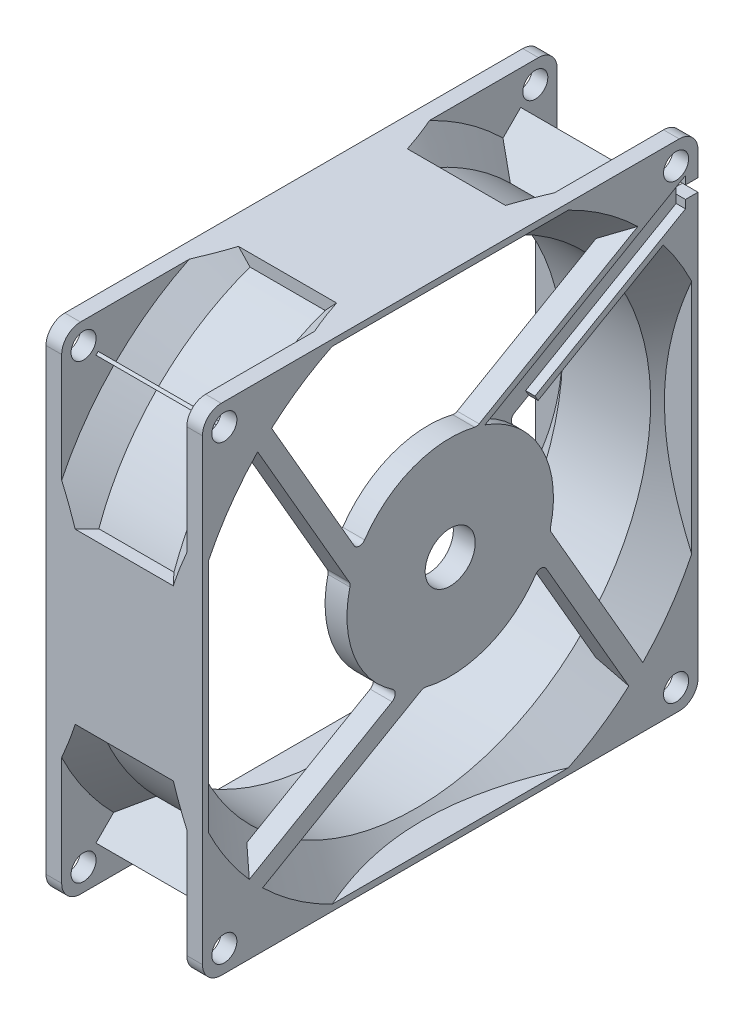
from build123d import *

# Parameters (mm, degrees)
SKETCH2_OUTSIDE_W               = 146.07
SKETCH2_OUTSIDE_H               = 146.07
CUT_EXTRUDE1_DEPTH              = 84.04817878797823
BOSS_EXTRUDE1_REACH             = 63.327
SKETCH3_W                       = 37.74341300100707
SKETCH3_H                       = 1
CIRPATTERN1_COUNT               = 4
MIRROR1_COPY_1_REACH            = 63.327
MIRROR1_COPY_1_SKETCH_W         = 37.74341300100707
MIRROR1_COPY_1_SKETCH_H         = 1
MIRROR1_COPY_2_REACH            = 63.327
MIRROR1_COPY_2_SKETCH_W         = 37.74341300100707
MIRROR1_COPY_2_SKETCH_H         = 1
MIRROR1_COPY_3_REACH            = 63.327
MIRROR1_COPY_3_SKETCH_W         = 37.74341300100707
MIRROR1_COPY_3_SKETCH_H         = 1
BOSS_EXTRUDE2_REACH             = 59.378
BOSS_EXTRUDE2_DIRECTION_2_REACH = 59.378
CIRPATTERN2_COUNT               = 4
SKETCH5_R                       = 2.0000000000000036
CUT_EXTRUDE2_DEPTH              = 62.32699242584839
CIRPATTERN3_COUNT               = 4
FILLET1_R                       = 3
SKETCH6_R                       = 4
BOSS_EXTRUDE3_DEPTH             = 3.5
CUT_EXTRUDE3_DEPTH              = 1.5
CUT_EXTRUDE4_REACH              = 62.731
SKETCH8_W                       = 2
SKETCH8_H                       = 2.0000000000000036
FILLET2_R                       = 1
BOSS_EXTRUDE4_REACH             = 91.422
BOSS_EXTRUDE4_END_RADIUS        = 40
CIRPATTERN4_COUNT               = 4


with BuildPart() as part:
    # Sketch1 → Revolve1 (revolve)
    with BuildSketch(Plane.XY, mode=Mode.PRIVATE) as revolve1_sk:
        Polygon((-9.999999999999982, 55.99999999999999), (-9.999999999999979, 44), (-6, 40), (6, 40), (9.99999999999998, 44), (9.999999999999979, 55.99999999999999), (12.499999999999982, 55.99999999999999), (12.499999999999984, 42.96446609406725), (7.035533905932737, 37.5), (-7.035533905932737, 37.5), (-12.499999999999979, 42.96446609406726), (-12.499999999999982, 55.99999999999999), align=None)
    revolve(revolve1_sk.sketch.rotate(Axis((-12.499999999999979, 0, 0), (1, 0, 0)), 90), axis=Axis((-12.499999999999979, 0, 0), (1, 0, 0)))

    # Sketch2 outside → Cut-Extrude1 (cut, through all)
    with BuildSketch(Plane(origin=(12.499999999999984, 0, 0), x_dir=(0, 0, -1), z_dir=(1, 0, 0))):
        Rectangle(SKETCH2_OUTSIDE_W, SKETCH2_OUTSIDE_H)
        Polygon((-39.59797974644666, 39.59797974644666), (39.59797974644666, 39.59797974644666), (39.59797974644667, -39.59797974644666), (-39.597979746446654, -39.59797974644666), align=None, mode=Mode.SUBTRACT)
    extrude(amount=-CUT_EXTRUDE1_DEPTH, mode=Mode.SUBTRACT)

    # Sketch3 → Boss-Extrude1 (add, up to next)
    with BuildSketch(Plane(origin=(12.499999999999984, 0, 0), x_dir=(0, 0, -1), z_dir=(1, 0, 0)), mode=Mode.PRIVATE) as boss_extrude1_sk1:
        with Locations((0, 39.09797974644666)):
            Rectangle(SKETCH3_W, SKETCH3_H)
    boss_extrude1_tool1 = extrude(boss_extrude1_sk1.sketch, amount=-BOSS_EXTRUDE1_REACH, mode=Mode.PRIVATE) - part.part
    boss_extrude1 = boss_extrude1_tool1.solids().sort_by_distance((12.5, 39.09798, 0))[0]
    add(boss_extrude1)

    # CirPattern1: Boss-Extrude1 ×4 about axis
    cirpattern1_axis = Axis((0, 0, 0), (1, 0, 0))
    for i in range(1, CIRPATTERN1_COUNT):
        add(boss_extrude1.rotate(cirpattern1_axis, i * 360 / CIRPATTERN1_COUNT))

    # Mirror1: Boss-Extrude1 across plane
    add(boss_extrude1.mirror(Plane(origin=(0, 0, 0), x_dir=(0, 0, 1), z_dir=(1, 0, 0))))

    # Mirror1 copy 1 sketch → Mirror1 copy 1 (add, up to next)
    with BuildSketch(Plane(origin=(-12.499999999999984, 0, 0), x_dir=(0, 1, -6e-17), z_dir=(-1, 0, 0)), mode=Mode.PRIVATE) as mirror1_copy_1_sk1:
        with Locations((0, -39.09797974644666)):
            Rectangle(MIRROR1_COPY_1_SKETCH_W, MIRROR1_COPY_1_SKETCH_H)
    mirror1_copy_1_tool1 = extrude(mirror1_copy_1_sk1.sketch, amount=-MIRROR1_COPY_1_REACH, mode=Mode.PRIVATE) - part.part
    add(mirror1_copy_1_tool1.solids().sort_by_distance((-12.5, 0, 39.09798))[0])

    # Mirror1 copy 2 sketch → Mirror1 copy 2 (add, up to next)
    with BuildSketch(Plane.ZY.offset(12.499999999999984), mode=Mode.PRIVATE) as mirror1_copy_2_sk1:
        with Locations((0, -39.09797974644666)):
            Rectangle(MIRROR1_COPY_2_SKETCH_W, MIRROR1_COPY_2_SKETCH_H)
    mirror1_copy_2_tool1 = extrude(mirror1_copy_2_sk1.sketch, amount=-MIRROR1_COPY_2_REACH, mode=Mode.PRIVATE) - part.part
    add(mirror1_copy_2_tool1.solids().sort_by_distance((-12.5, -39.09798, 0))[0])

    # Mirror1 copy 3 sketch → Mirror1 copy 3 (add, up to next)
    with BuildSketch(Plane(origin=(-12.499999999999984, 0, 0), x_dir=(0, -1, 1.8e-16), z_dir=(-1, 0, 0)), mode=Mode.PRIVATE) as mirror1_copy_3_sk1:
        with Locations((0, -39.09797974644666)):
            Rectangle(MIRROR1_COPY_3_SKETCH_W, MIRROR1_COPY_3_SKETCH_H)
    mirror1_copy_3_tool1 = extrude(mirror1_copy_3_sk1.sketch, amount=-MIRROR1_COPY_3_REACH, mode=Mode.PRIVATE) - part.part
    add(mirror1_copy_3_tool1.solids().sort_by_distance((-12.5, 0, -39.09798))[0])

    # Sketch4 → Boss-Extrude2 (add, up to next)
    with BuildSketch(Plane(origin=(0, 0, 0), x_dir=(0, 0, -1), z_dir=(1, 0, 0)), mode=Mode.PRIVATE) as boss_extrude2_sk1:
        Polygon((33.76434880165763, 34.117902192250924), (26.33913833700047, 26.69269172759376), (26.69269172759376, 26.33913833700047), (34.11790219225093, 33.764348801657626), align=None)
    boss_extrude2_tool1 = extrude(boss_extrude2_sk1.sketch, amount=BOSS_EXTRUDE2_REACH, mode=Mode.PRIVATE) - part.part
    boss_extrude2 = boss_extrude2_tool1.solids().sort_by_distance((0, 30.22852, -30.22852))[0]
    add(boss_extrude2)

    # Sketch4 → Boss-Extrude2 direction 2 (add, up to next)
    with BuildSketch(Plane(origin=(0, 0, 0), x_dir=(0, 0, -1), z_dir=(1, 0, 0)), mode=Mode.PRIVATE) as boss_extrude2_direction_2_sk1:
        Polygon((33.76434880165763, 34.117902192250924), (26.33913833700047, 26.69269172759376), (26.69269172759376, 26.33913833700047), (34.11790219225093, 33.764348801657626), align=None)
    boss_extrude2_direction_2_tool1 = extrude(boss_extrude2_direction_2_sk1.sketch, amount=-BOSS_EXTRUDE2_DIRECTION_2_REACH, mode=Mode.PRIVATE) - part.part
    boss_extrude2_direction_2 = boss_extrude2_direction_2_tool1.solids().sort_by_distance((0, 30.22852, -30.22852))[0]
    add(boss_extrude2_direction_2)

    # CirPattern2: Boss-Extrude2, Boss-Extrude2 direction 2 ×4 about axis
    cirpattern2_axis = Axis((0, 7e-17, 2.03e-15), (1, 0, 0))
    add([boss_extrude2.rotate(cirpattern2_axis, i * 360 / CIRPATTERN2_COUNT) for i in range(1, CIRPATTERN2_COUNT)])
    add([boss_extrude2_direction_2.rotate(cirpattern2_axis, i * 360 / CIRPATTERN2_COUNT) for i in range(1, CIRPATTERN2_COUNT)])

    # Sketch5 → Cut-Extrude2 (cut, through all)
    with BuildSketch(Plane(origin=(12.499999999999984, 0, 0), x_dir=(0, 0, -1), z_dir=(1, 0, 0))):
        with Locations((36.09797974644666, -36.097979746446654)):
            Circle(SKETCH5_R)
    cut_extrude2 = extrude(amount=-CUT_EXTRUDE2_DEPTH, mode=Mode.SUBTRACT)

    # CirPattern3: Cut-Extrude2 ×4 about axis
    cirpattern3_axis = Axis((0, -6.245e-14, 6.245e-14), (1, 0, 0))
    for i in range(1, CIRPATTERN3_COUNT):
        add(cut_extrude2.rotate(cirpattern3_axis, i * 360 / CIRPATTERN3_COUNT), mode=Mode.SUBTRACT)

    # Fillet1
    fillet1_edges = [part.edges().sort_by_distance(p)[0] for p in [
        (11.249999999999982, -39.59797974644666, -39.59797974644667),
        (-11.24999999999998, -39.59797974644666, -39.59797974644667),
        (11.249999999999982, -39.59797974644666, 39.597979746446654),
        (-11.24999999999998, -39.59797974644666, 39.597979746446654),
        (11.249999999999982, 39.59797974644666, 39.59797974644666),
        (-11.24999999999998, 39.59797974644666, 39.59797974644666),
        (11.249999999999982, 39.59797974644666, -39.59797974644666),
        (-11.24999999999998, 39.59797974644666, -39.59797974644666),
    ]]
    fillet(fillet1_edges, radius=FILLET1_R)

    # Sketch6 → Boss-Extrude3 (add)
    with BuildSketch(Plane(origin=(12.499999999999984, 0, 0), x_dir=(0, 0, -1), z_dir=(1, 0, 0))):
        with BuildLine():
            Line((29.976496953072278, 30.779132170525894), (4.270514244191484, 15.937776133769656))
            ThreePointArc((4.270514244191484, 15.937776133769656), (-6.5380934396241654, 15.149367451307777), (-14.526193110031757, 7.825580727975779))
            Line((-14.526193110031757, 7.825580727975779), (-28.54664833090146, 32.10972151576676))
            ThreePointArc((-28.54664833090146, 32.10972151576676), (-29.68206057174266, 31.063171553523844), (-30.779132170525745, 29.976496953072438))
            Line((-30.779132170525745, 29.976496953072438), (-15.937776133769656, 4.270514244191488))
            ThreePointArc((-15.937776133769656, 4.270514244191488), (-15.149367451307702, -6.5380934396243395), (-7.825580727975507, -14.526193110032072))
            Line((-7.825580727975507, -14.526193110032072), (-32.10972151576648, -28.546648330901775))
            ThreePointArc((-32.10972151576648, -28.546648330901775), (-31.06317155352356, -29.682060571742976), (-29.97649695307216, -30.779132170526058))
            Line((-29.97649695307216, -30.779132170526058), (-4.270514244191213, -15.937776133769969))
            ThreePointArc((-4.270514244191213, -15.937776133769969), (6.538093439624522, -15.149367451307873), (14.526193110032342, -7.825580727975819))
            Line((14.526193110032342, -7.825580727975819), (28.54664833090205, -32.10972151576679))
            ThreePointArc((28.54664833090205, -32.10972151576679), (29.682060571743243, -31.063171553523873), (30.77913217052633, -29.976496953072477))
            Line((30.77913217052633, -29.976496953072477), (15.937776133770239, -4.270514244191527))
            ThreePointArc((15.937776133770239, -4.270514244191527), (15.732495145305311, 4.9737909589129075), (10.586469911992962, 12.65609160848908))
            Line((10.586469911992962, 12.65609160848908), (34.04957142522472, 26.202519583176993))
            ThreePointArc((34.04957142522472, 26.202519583176993), (32.09471457560046, 28.56351944454662), (29.976496953072278, 30.779132170525894))
        make_face()
        Circle(SKETCH6_R, mode=Mode.SUBTRACT)
    extrude(amount=-BOSS_EXTRUDE3_DEPTH)

    # Sketch7 → Cut-Extrude3 (cut)
    with BuildSketch(Plane(origin=(12.499999999999984, 0, 0), x_dir=(0, 0, -1), z_dir=(1, 0, 0))):
        with BuildLine():
            Line((5.567958060230887, 15.532155131839216), (37.59797974644667, 34.02469677452545))
            Line((37.59797974644667, 34.02469677452545), (37.59797974644667, 32.71529569776699))
            Line((37.59797974644667, 32.71529569776699), (39.59797974644667, 32.71529569776699))
            Line((39.59797974644667, 32.71529569776699), (39.59797974644667, 30.715295697766987))
            Line((39.59797974644667, 30.715295697766987), (37.59797974644667, 30.715295697766987))
            Line((37.59797974644667, 30.715295697766987), (37.59797974644667, 29.40589462100852))
            Line((37.59797974644667, 29.40589462100852), (13.550571527130899, 15.522117012273739))
            Line((13.550571527130899, 15.522117012273739), (14.050571527130899, 14.6560916084893))
            Line((14.050571527130899, 14.6560916084893), (10.586469911993143, 12.656091608489302))
            ThreePointArc((10.586469911993143, 12.656091608489302), (8.20422580899804, 14.315749329845778), (5.567958060230887, 15.532155131839216))
        make_face()
    extrude(amount=-CUT_EXTRUDE3_DEPTH, mode=Mode.SUBTRACT)

    # Sketch8 → Cut-Extrude4 (cut, up to next)
    with BuildSketch(Plane(origin=(10.999999999999984, 0, 0), x_dir=(0, 0, -1), z_dir=(1, 0, 0)), mode=Mode.PRIVATE) as cut_extrude4_sk1:
        with Locations((38.59797974644667, 31.71529569776699)):
            Rectangle(SKETCH8_W, SKETCH8_H)
    cut_extrude4_tool1 = extrude(cut_extrude4_sk1.sketch, amount=-CUT_EXTRUDE4_REACH, mode=Mode.PRIVATE) & part.part
    add(cut_extrude4_tool1.solids().sort_by_distance((11, 31.715296, -38.59798))[0], mode=Mode.SUBTRACT)

    # Fillet2
    fillet2_edges = [part.edges().sort_by_distance(p)[0] for p in [
        (10.749999999999984, -4.270514244191527, -15.937776133770239),
        (10.749999999999984, -15.937776133769969, 4.270514244191213),
        (10.749999999999984, 4.270514244191489, 15.937776133769656),
        (10.749999999999984, 15.937776133769656, -4.270514244191485),
        (9.999999999999984, 12.656091608489081, -10.586469911992964),
        (10.749999999999984, -7.82558072797582, -14.526193110032342),
        (10.749999999999984, -14.526193110032072, 7.825580727975508),
        (10.749999999999984, 7.825580727975778, 14.526193110031759),
    ]]
    fillet(fillet2_edges, radius=FILLET2_R)

    # Boss-Extrude4: up to this cylinder (the profile starts outside it)
    boss_extrude4_end = Plane(origin=(0, 0, 0), z_dir=(-1, 0, 0)) * Cylinder(BOSS_EXTRUDE4_END_RADIUS, 263.844, mode=Mode.PRIVATE)
    # Sketch9 → Boss-Extrude4 (add, up to the surface)
    with BuildSketch(Plane(origin=(0, 3.47e-15, -39.59797974644666), x_dir=(-1, 0, 0), z_dir=(0, 9e-17, -1)), mode=Mode.PRIVATE) as boss_extrude4_sk1:
        with BuildLine():
            Line((7.835989291516807, 13.5), (-7.835989291516811, 13.5))
            add(Edge.make_bspline(
                [(-5.999999999999993, 5.656854249492334), (-6.542151842389164, 9.490446691354007), (-7.835989291517298, 13.499999999998176)],
                knots=[0.14237564316780327, 0.14237564316780327, 0.14237564316780327, 0.3347087405415428, 0.3347087405415428, 0.3347087405415428], degree=2, weights=[1, 1.0078279990235202, 1.0063876388238429]))
            Line((-6, 5.656854249492381), (6, 5.656854249492381))
            add(Edge.make_bspline(
                [(7.835989291517294, 13.49999999999817), (6.542151842389164, 9.490446691354004), (5.999999999999993, 5.656854249492334)],
                knots=[-0.3347087405415427, -0.3347087405415427, -0.3347087405415427, -0.14237564316780327, -0.14237564316780327, -0.14237564316780327], degree=2, weights=[1.0063876388238429, 1.0078279990235202, 1]))
        make_face()
    boss_extrude4_tool1 = extrude(boss_extrude4_sk1.sketch, amount=-BOSS_EXTRUDE4_REACH, mode=Mode.PRIVATE) - boss_extrude4_end
    # Sketch9 → Boss-Extrude4 (add, up to the surface)
    with BuildSketch(Plane(origin=(0, 3.47e-15, -39.59797974644666), x_dir=(-1, 0, 0), z_dir=(0, 9e-17, -1)), mode=Mode.PRIVATE) as boss_extrude4_sk2:
        with BuildLine():
            add(Edge.make_bspline(
                [(-7.835989291517299, -13.499999999998176), (-6.542151842389168, -9.490446691354016), (-5.999999999999993, -5.656854249492343)],
                knots=[-0.3347087405415426, -0.3347087405415426, -0.3347087405415426, -0.1423756431678035, -0.1423756431678035, -0.1423756431678035], degree=2, weights=[1.0063876388238429, 1.0078279990235202, 1]))
            Line((-7.835989291516812, -13.5), (7.83598929151681, -13.5))
            add(Edge.make_bspline(
                [(5.999999999999993, -5.656854249492343), (6.542151842389168, -9.490446691354016), (7.835989291517298, -13.499999999998176)],
                knots=[0.1423756431678035, 0.1423756431678035, 0.1423756431678035, 0.3347087405415426, 0.3347087405415426, 0.3347087405415426], degree=2, weights=[1, 1.0078279990235202, 1.0063876388238429]))
            Line((6, -5.656854249492381), (-6, -5.656854249492381))
        make_face()
    boss_extrude4_tool2 = extrude(boss_extrude4_sk2.sketch, amount=-BOSS_EXTRUDE4_REACH, mode=Mode.PRIVATE) - boss_extrude4_end
    boss_extrude4 = boss_extrude4_tool1.solids().sort_by_distance((0, 9.755221, -39.59798))[0] + boss_extrude4_tool2.solids().sort_by_distance((0, -9.755221, -39.59798))[0]
    add(boss_extrude4)

    # CirPattern4: Boss-Extrude4 ×4 about axis
    cirpattern4_axis = Axis((0, 2.9e-16, 8.7e-16), (1, 0, 0))
    for i in range(1, CIRPATTERN4_COUNT):
        add(boss_extrude4.rotate(cirpattern4_axis, i * 360 / CIRPATTERN4_COUNT))


solid = part.part
